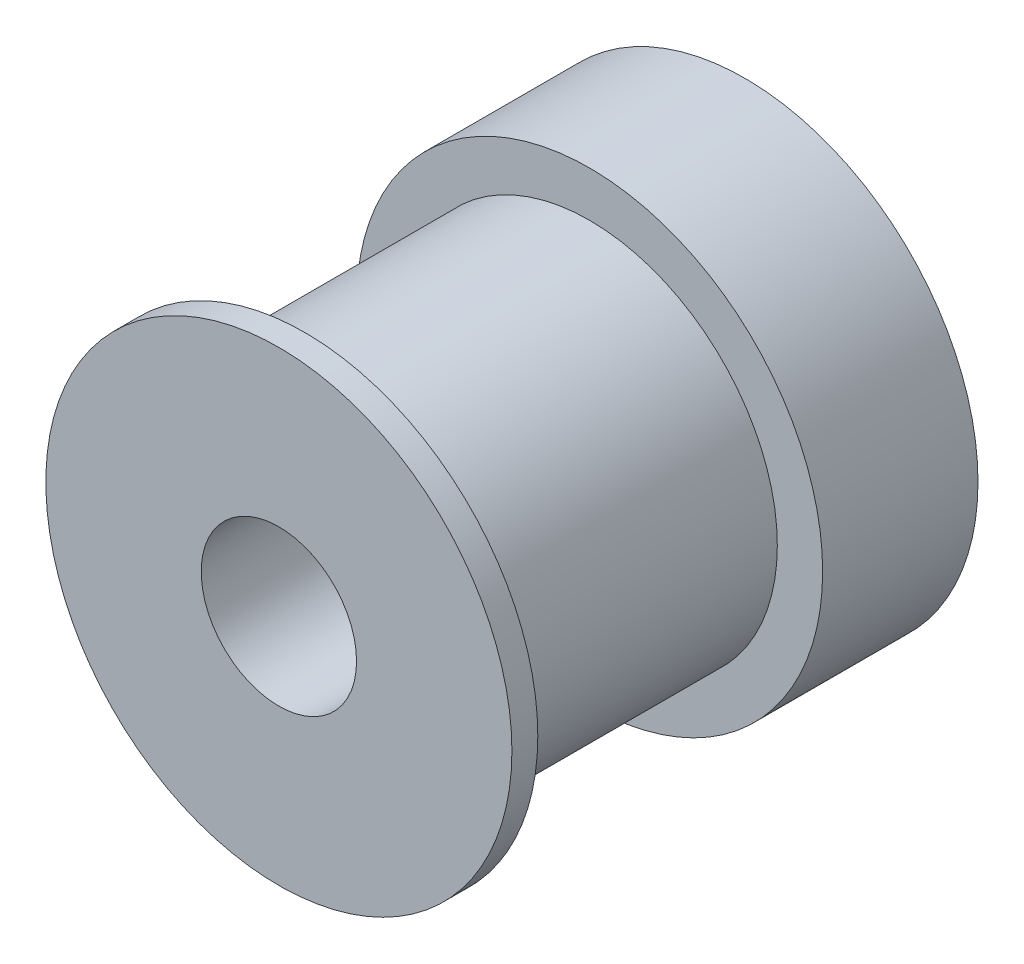
from build123d import *

# Parameters (mm, degrees)
SKETCH1_R           = 9
SKETCH1_R_2         = 3
BOSS_EXTRUDE1_DEPTH = 6
SKETCH2_R           = 7.25
SKETCH2_R_2         = 3
BOSS_EXTRUDE2_DEPTH = 11
SKETCH3_R           = 9
SKETCH3_R_2         = 3
BOSS_EXTRUDE3_DEPTH = 1
SKETCH4_R           = 1.5
CUT_EXTRUDE1_DEPTH  = 23.045407685


with BuildPart() as part:
    # Sketch1 → Boss-Extrude1 (new body)
    with BuildSketch(Plane.XY):
        Circle(SKETCH1_R)
        Circle(SKETCH1_R_2, mode=Mode.SUBTRACT)
    extrude(amount=BOSS_EXTRUDE1_DEPTH)

    # Sketch2 → Boss-Extrude2 (add)
    with BuildSketch(Plane.XY.offset(6)):
        Circle(SKETCH2_R)
        Circle(SKETCH2_R_2, mode=Mode.SUBTRACT)
    extrude(amount=BOSS_EXTRUDE2_DEPTH)

    # Sketch3 → Boss-Extrude3 (add)
    with BuildSketch(Plane.XY.offset(17)):
        Circle(SKETCH3_R)
        Circle(SKETCH3_R_2, mode=Mode.SUBTRACT)
    extrude(amount=BOSS_EXTRUDE3_DEPTH)

    # Sketch4 → Cut-Extrude1 (cut, through all)
    with BuildSketch(Plane(origin=(0, 0, 0), x_dir=(1, 0, 0), z_dir=(0, 1, 0))):
        with Locations(Location((0, -4, 0), (0, 0, 270))):
            Circle(SKETCH4_R)
    extrude(amount=-CUT_EXTRUDE1_DEPTH, mode=Mode.SUBTRACT)


solid = part.part
